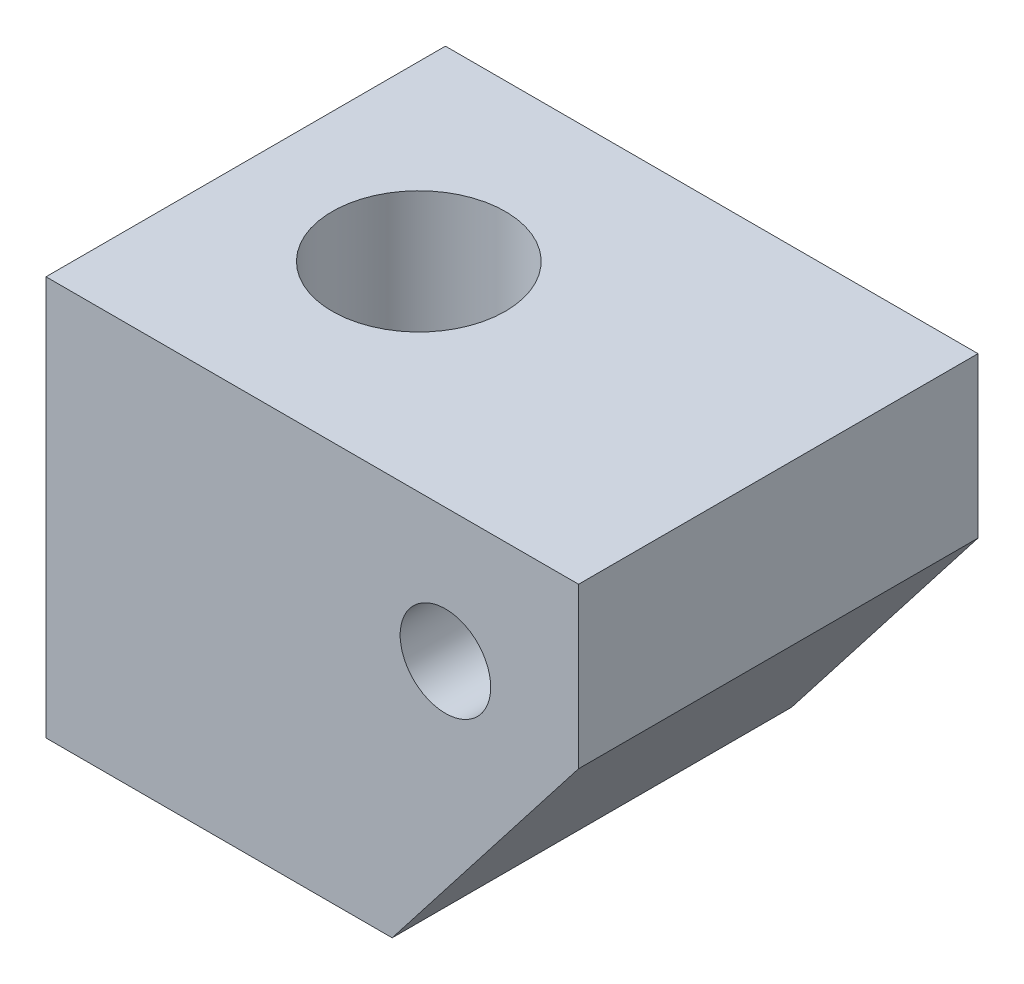
from build123d import *

# Parameters (mm, degrees)
ESTRUSIONE_ESTRUSIONE1_DEPTH = 15
FORO_PER_VITE_M3_1_D         = 3.4
SCHIZZO5_R                   = 3.25
TAGLIO_ESTRUSIONE1_DEPTH     = 25.879710609


with BuildPart() as part:
    # Schizzo1 → Estrusione-Estrusione1 (new body)
    with BuildSketch(Plane.XY):
        Polygon((0, 0), (-13, 0), (-13, 15), (7, 15), (7, 9), align=None)
    extrude(amount=ESTRUSIONE_ESTRUSIONE1_DEPTH)

    # Foro per Vite M3-1 (through all)
    with Locations(Plane.XY.offset(15)):
        with Locations((2, 10)):
            Hole(FORO_PER_VITE_M3_1_D / 2)

    # Schizzo5 → Taglio-Estrusione1 (cut, through all)
    with BuildSketch(Plane(origin=(0, 0, 0), x_dir=(-1, 0, 0), z_dir=(0, -1, 0))):
        with Locations(Location((6.5, -7.5, 0), (0, 0, 180))):
            Circle(SCHIZZO5_R)
    extrude(amount=-TAGLIO_ESTRUSIONE1_DEPTH, mode=Mode.SUBTRACT)


solid = part.part
